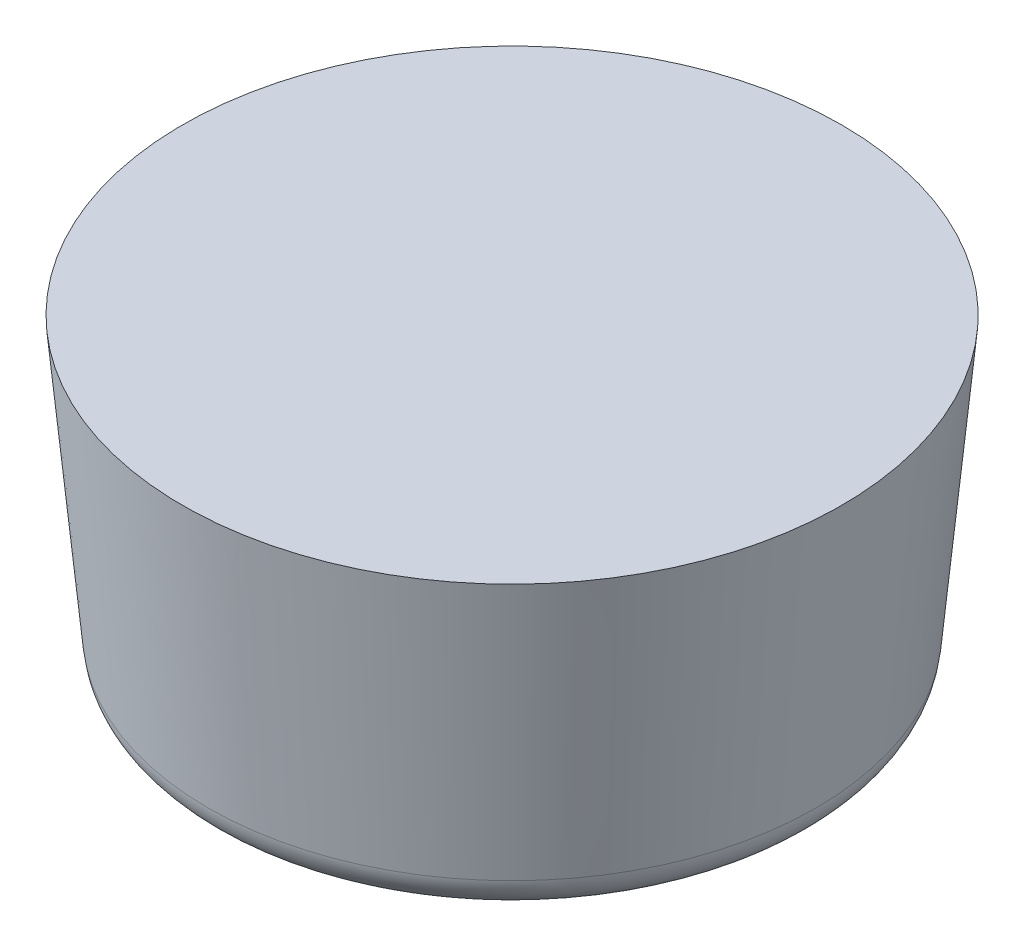
from build123d import *

# Parameters (mm, degrees)
REDONDEO1_R = 2


with BuildPart() as part:
    # Croquis1 → Revolución1 (revolve)
    with BuildSketch(Plane(origin=(0, 0, 0), x_dir=(0, 0, -1), z_dir=(1, 0, 0)), mode=Mode.PRIVATE) as revoluci_n1_sk:
        Polygon((0, 16), (-17, 16), (-15.5, 0), (-7.5, 0), (-7.5, 7), (-2.5, 7), (-2.5, 12), (0, 12), align=None)
    revolve(revoluci_n1_sk.sketch.rotate(Axis((0, 0, 0), (0, 1, 0)), 180), axis=Axis((0, 0, 0), (0, 1, 0)))

    # Redondeo1
    redondeo1_edges = [part.edges().sort_by_distance(p)[0] for p in [
        (0, 0, 7.5),
        (0, 0, 15.5),
    ]]
    fillet(redondeo1_edges, radius=REDONDEO1_R)


solid = part.part
